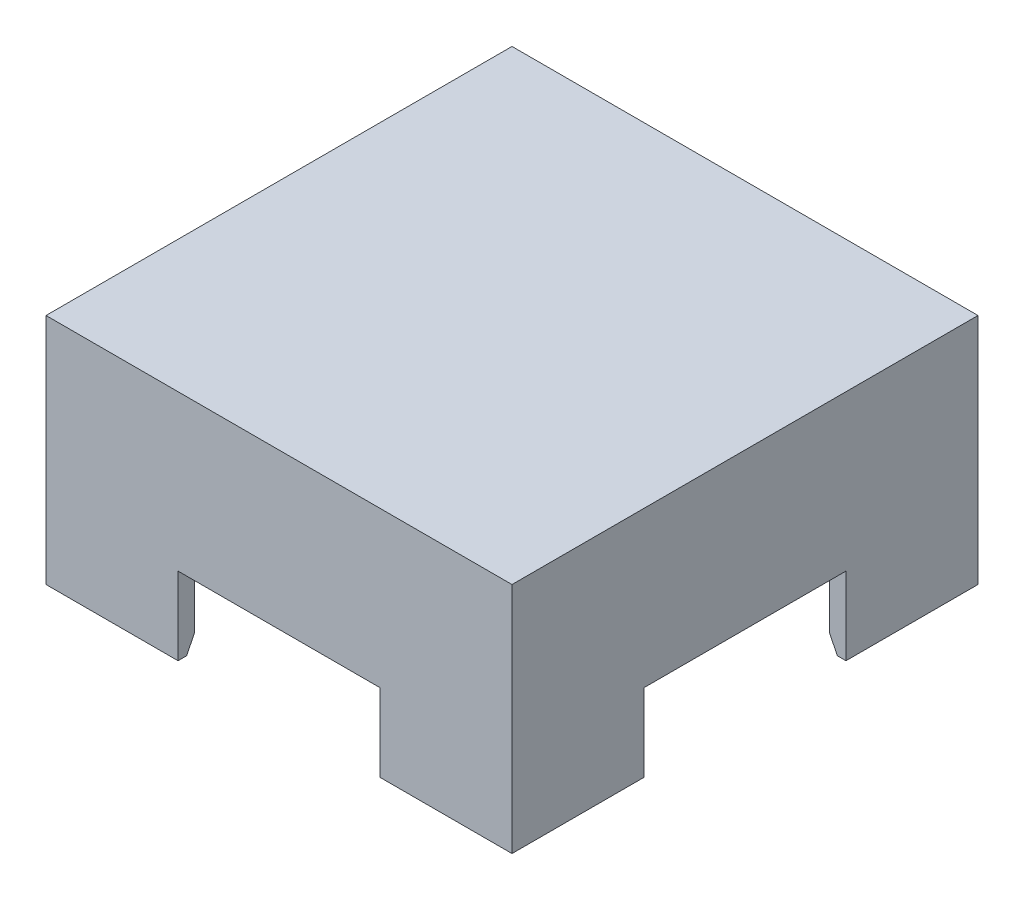
from build123d import *
from OCP.BRepFilletAPI import BRepFilletAPI_MakeChamfer

# Parameters (mm, degrees)
SKETCH1_W           = 76.2
SKETCH1_H           = 76.2
BOSS_EXTRUDE1_DEPTH = 25.4
SKETCH2_W           = 57.15
SKETCH2_H           = 57.15
CUT_EXTRUDE1_DEPTH  = 19.05
BOSS_EXTRUDE2_DEPTH = 12.7
CHAMFER1_SIZE       = 2.54
CHAMFER1_SIZE2      = 1.27


with BuildPart() as part:
    # Sketch1 → Boss-Extrude1 (new body)
    with BuildSketch(Plane(origin=(0, 1478.617106037, 0), x_dir=(1, 0, 0), z_dir=(0, 1, 0))):
        with Locations((-492.049198231, -806.92955637)):
            Rectangle(SKETCH1_W, SKETCH1_H)
    extrude(amount=BOSS_EXTRUDE1_DEPTH)

    # Sketch2 → Cut-Extrude1 (cut)
    with BuildSketch(Plane(origin=(0, 1478.617106037, 0), x_dir=(-1, 0, 0), z_dir=(0, -1, 0))):
        with Locations((492.049198231, -806.92955637)):
            Rectangle(SKETCH2_W, SKETCH2_H)
    extrude(amount=-CUT_EXTRUDE1_DEPTH, mode=Mode.SUBTRACT)

    # Sketch3 → Boss-Extrude2 (add)
    with BuildSketch(Plane(origin=(0, 1478.617106037, 0), x_dir=(-1, 0, 0), z_dir=(0, -1, 0))):
        Polygon((530.149198231, -790.41955637), (527.482198231, -790.41955637), (527.482198231, -771.49655637), (508.559198231, -771.49655637), (508.559198231, -768.82955637), (530.149198231, -768.82955637), align=None)
        Polygon((530.149198231, -823.43955637), (527.482198231, -823.43955637), (527.482198231, -842.36255637), (508.559198231, -842.36255637), (508.559198231, -845.02955637), (530.149198231, -845.02955637), align=None)
        Polygon((475.539198231, -768.82955637), (475.539198231, -771.49655637), (456.616198231, -771.49655637), (456.616198231, -790.41955637), (453.949198231, -790.41955637), (453.949198231, -768.82955637), align=None)
        Polygon((475.539198231, -845.02955637), (475.539198231, -842.36255637), (456.616198231, -842.36255637), (456.616198231, -823.43955637), (453.949198231, -823.43955637), (453.949198231, -845.02955637), align=None)
    extrude(amount=BOSS_EXTRUDE2_DEPTH)

    # Chamfer1: one chamfer whose edges measure the first distance from different faces: ONE call of the kernel's chamfer builder (chamfer() names one face for all edges)
    chamfer1_edges_1 = [part.edges().sort_by_distance(p)[0] for p in [
        (-518.020698231, 1465.917106037, 771.49655637),
    ]]
    chamfer1_side_1 = [part.faces().sort_by_distance(p)[0] for p in [
        (-518.020698231, 1472.267106037, 771.49655637),
    ]]
    chamfer1_edges_2 = [part.edges().sort_by_distance(p)[0] for p in [
        (-527.482198231, 1465.917106037, 780.95805637),
    ]]
    chamfer1_side_2 = [part.faces().sort_by_distance(p)[0] for p in [
        (-527.482198231, 1472.267106037, 780.95805637),
    ]]
    chamfer1_edges_3 = [part.edges().sort_by_distance(p)[0] for p in [
        (-527.482198231, 1465.917106037, 832.90105637),
    ]]
    chamfer1_side_3 = [part.faces().sort_by_distance(p)[0] for p in [
        (-527.482198231, 1472.267106037, 832.90105637),
    ]]
    chamfer1_edges_4 = [part.edges().sort_by_distance(p)[0] for p in [
        (-518.020698231, 1465.917106037, 842.36255637),
    ]]
    chamfer1_side_4 = [part.faces().sort_by_distance(p)[0] for p in [
        (-518.020698231, 1472.267106037, 842.36255637),
    ]]
    chamfer1_edges_5 = [part.edges().sort_by_distance(p)[0] for p in [
        (-466.077698231, 1465.917106037, 771.49655637),
    ]]
    chamfer1_side_5 = [part.faces().sort_by_distance(p)[0] for p in [
        (-466.077698231, 1472.267106037, 771.49655637),
    ]]
    chamfer1_edges_6 = [part.edges().sort_by_distance(p)[0] for p in [
        (-456.616198231, 1465.917106037, 780.95805637),
    ]]
    chamfer1_side_6 = [part.faces().sort_by_distance(p)[0] for p in [
        (-456.616198231, 1472.267106037, 780.95805637),
    ]]
    chamfer1_edges_7 = [part.edges().sort_by_distance(p)[0] for p in [
        (-466.077698231, 1465.917106037, 842.36255637),
    ]]
    chamfer1_side_7 = [part.faces().sort_by_distance(p)[0] for p in [
        (-466.077698231, 1472.267106037, 842.36255637),
    ]]
    chamfer1_edges_8 = [part.edges().sort_by_distance(p)[0] for p in [
        (-456.616198231, 1465.917106037, 832.90105637),
    ]]
    chamfer1_side_8 = [part.faces().sort_by_distance(p)[0] for p in [
        (-456.616198231, 1472.267106037, 832.90105637),
    ]]
    chamfer1 = BRepFilletAPI_MakeChamfer(part.part.solid().wrapped)
    for e in chamfer1_edges_1:
        chamfer1.Add(CHAMFER1_SIZE, CHAMFER1_SIZE2, e.wrapped, chamfer1_side_1[0].wrapped)  # the first distance lies on this face
    for e in chamfer1_edges_2:
        chamfer1.Add(CHAMFER1_SIZE, CHAMFER1_SIZE2, e.wrapped, chamfer1_side_2[0].wrapped)  # the first distance lies on this face
    for e in chamfer1_edges_3:
        chamfer1.Add(CHAMFER1_SIZE, CHAMFER1_SIZE2, e.wrapped, chamfer1_side_3[0].wrapped)  # the first distance lies on this face
    for e in chamfer1_edges_4:
        chamfer1.Add(CHAMFER1_SIZE, CHAMFER1_SIZE2, e.wrapped, chamfer1_side_4[0].wrapped)  # the first distance lies on this face
    for e in chamfer1_edges_5:
        chamfer1.Add(CHAMFER1_SIZE, CHAMFER1_SIZE2, e.wrapped, chamfer1_side_5[0].wrapped)  # the first distance lies on this face
    for e in chamfer1_edges_6:
        chamfer1.Add(CHAMFER1_SIZE, CHAMFER1_SIZE2, e.wrapped, chamfer1_side_6[0].wrapped)  # the first distance lies on this face
    for e in chamfer1_edges_7:
        chamfer1.Add(CHAMFER1_SIZE, CHAMFER1_SIZE2, e.wrapped, chamfer1_side_7[0].wrapped)  # the first distance lies on this face
    for e in chamfer1_edges_8:
        chamfer1.Add(CHAMFER1_SIZE, CHAMFER1_SIZE2, e.wrapped, chamfer1_side_8[0].wrapped)  # the first distance lies on this face
    add(Compound.cast(chamfer1.Shape()), mode=Mode.REPLACE)


solid = part.part
